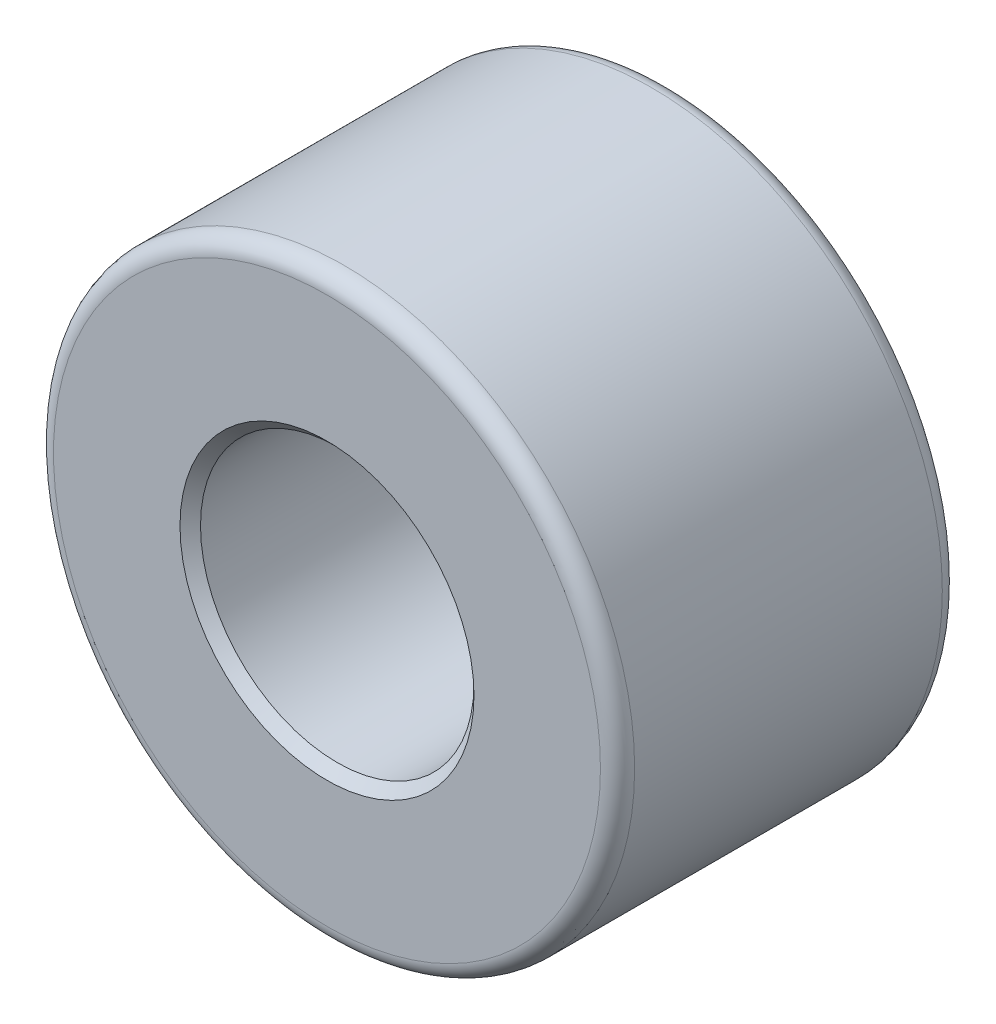
from build123d import *

# Parameters (mm, degrees)
SKETCH1_R           = 8.5
SKETCH1_R_2         = 4
BOSS_EXTRUDE1_DEPTH = 10
FILLET1_R           = 0.5
CHAMFER1_SIZE       = 0.3


with BuildPart() as part:
    # Sketch1 → Boss-Extrude1 (new body)
    with BuildSketch(Plane.XY):
        Circle(SKETCH1_R)
        Circle(SKETCH1_R_2, mode=Mode.SUBTRACT)
    extrude(amount=BOSS_EXTRUDE1_DEPTH)

    # Fillet1
    fillet1_edges = [part.edges().sort_by_distance(p)[0] for p in [
        (-8.5, 0, 0),
        (-8.5, 0, 10),
    ]]
    fillet(fillet1_edges, radius=FILLET1_R)

    # Chamfer1
    chamfer1_edges = [part.edges().sort_by_distance(p)[0] for p in [
        (-4, 0, 0),
        (-4, 0, 10),
    ]]
    chamfer(chamfer1_edges, length=CHAMFER1_SIZE)


solid = part.part
